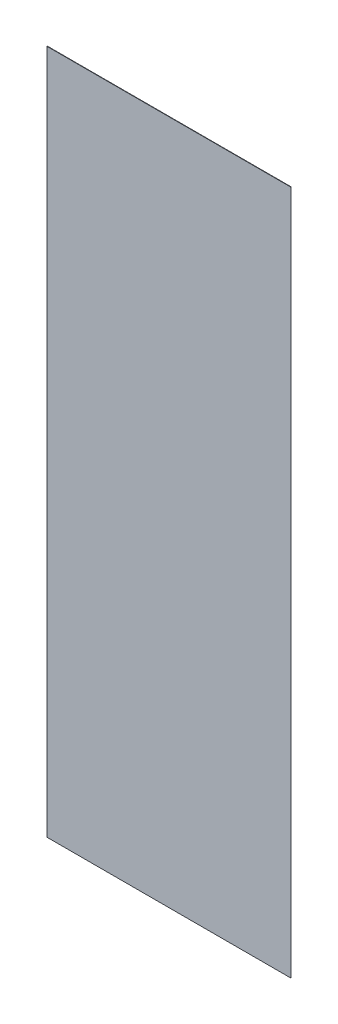
from build123d import *

# Parameters (mm, degrees)
TOPPING_IC_ARKA_1_START = -797.5
SKETCH1_W               = 615
SKETCH1_H               = 1727
TOPPING_IC_ARKA_1_DEPTH = 1


with BuildPart() as part:
    # Sketch1 → TOPPING_ic_arka_1 (new body)
    with BuildSketch(Plane.XY.offset(TOPPING_IC_ARKA_1_START)):
        with Locations((350, 1105)):
            Rectangle(SKETCH1_W, SKETCH1_H)
    extrude(amount=-TOPPING_IC_ARKA_1_DEPTH)


solid = part.part
